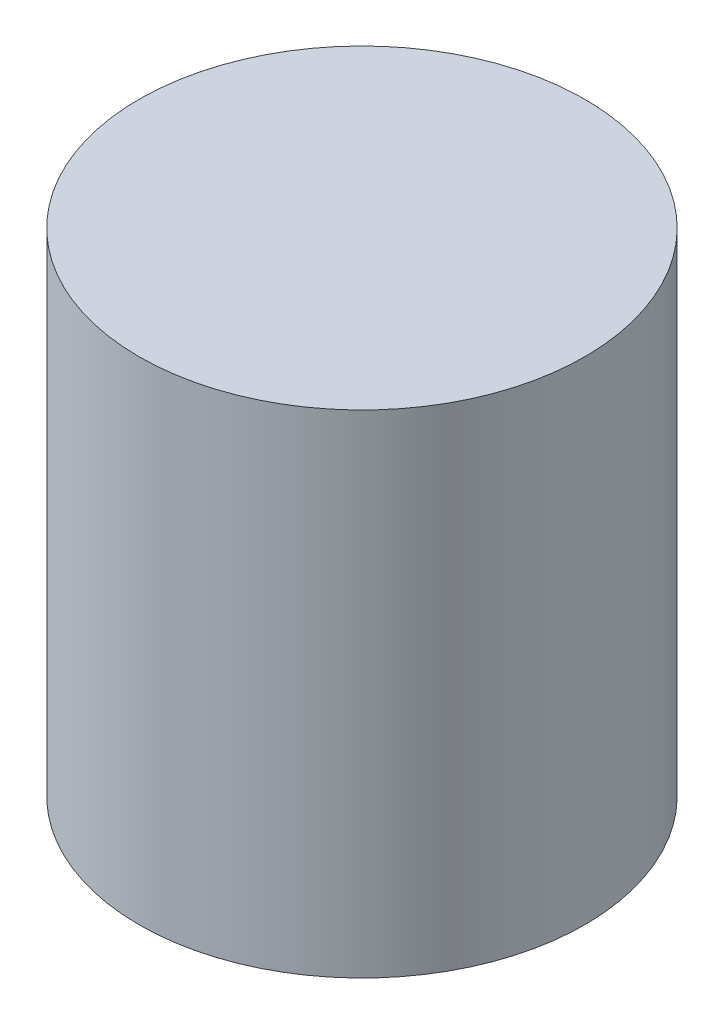
from build123d import *

# Parameters (mm, degrees)
SCHIZZO1_R                   = 14.5
ESTRUSIONE_ESTRUSIONE1_DEPTH = 32


with BuildPart() as part:
    # Schizzo1 → Estrusione-Estrusione1 (new body)
    with BuildSketch(Plane(origin=(0, 0, 0), x_dir=(1, 0, 0), z_dir=(0, 1, 0))):
        with Locations(Location((0, 0, 0), (0, 0, 270))):
            Circle(SCHIZZO1_R)
    extrude(amount=ESTRUSIONE_ESTRUSIONE1_DEPTH)


solid = part.part
